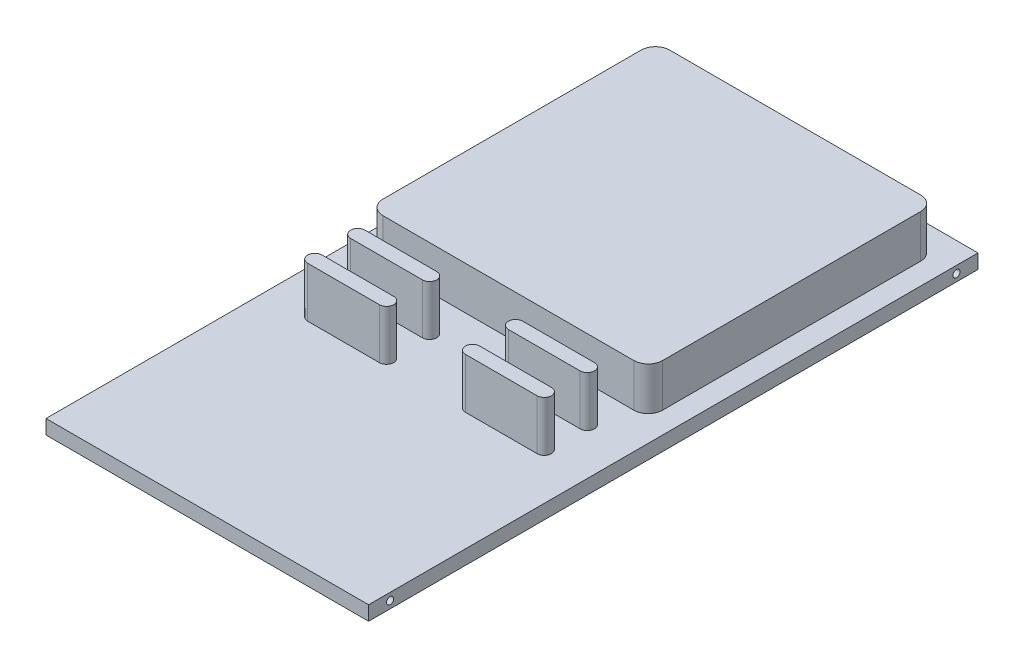
from build123d import *

# Parameters (mm, degrees)
SKETCH1_W           = 57.15
SKETCH1_H           = 107.95
BOSS_EXTRUDE1_DEPTH = 2.54
BOSS_EXTRUDE2_DEPTH = 8.89
SKETCH4_R           = 0.635
CUT_EXTRUDE1_DEPTH  = 10.16
SKETCH5_W           = 49.53
SKETCH5_H           = 50.8
BOSS_EXTRUDE3_DEPTH = 7.62
FILLET1_R           = 2.54


with BuildPart() as part:
    # Sketch1 → Boss-Extrude1 (new body)
    with BuildSketch(Plane(origin=(0, 0, 0), x_dir=(1, 0, 0), z_dir=(0, 1, 0))):
        with Locations((28.575, 53.975)):
            Rectangle(SKETCH1_W, SKETCH1_H)
    extrude(amount=BOSS_EXTRUDE1_DEPTH)

    # Sketch2 → Boss-Extrude2 (add)
    with BuildSketch(Plane(origin=(0, 2.54, 0), x_dir=(1, 0, 0), z_dir=(0, 1, 0))):
        with BuildLine():
            Line((8.255, 40.64), (20.955, 40.64))
            ThreePointArc((20.955, 40.64), (22.225, 39.37), (20.955, 38.1))
            Line((20.955, 38.1), (8.255, 38.1))
            ThreePointArc((8.255, 38.1), (6.985, 39.37), (8.255, 40.64))
        make_face()
        with BuildLine():
            Line((48.895, 40.64), (36.195, 40.64))
            ThreePointArc((36.195, 40.64), (34.925, 39.37), (36.195, 38.1))
            Line((36.195, 38.1), (48.895, 38.1))
            ThreePointArc((48.895, 38.1), (50.165, 39.37), (48.895, 40.64))
        make_face()
        with BuildLine():
            Line((8.255, 48.26), (20.955, 48.26))
            ThreePointArc((20.955, 48.26), (22.225, 46.99), (20.955, 45.72))
            Line((20.955, 45.72), (8.255, 45.72))
            ThreePointArc((8.255, 45.72), (6.985, 46.99), (8.255, 48.26))
        make_face()
        with BuildLine():
            Line((48.895, 48.26), (36.195, 48.26))
            ThreePointArc((36.195, 48.26), (34.925, 46.99), (36.195, 45.72))
            Line((36.195, 45.72), (48.895, 45.72))
            ThreePointArc((48.895, 45.72), (50.165, 46.99), (48.895, 48.26))
        make_face()
    extrude(amount=BOSS_EXTRUDE2_DEPTH)

    # Sketch4 → Cut-Extrude1 (cut)
    with BuildSketch(Plane.ZY):
        with Locations((-104.14, 1.27)):
            Circle(SKETCH4_R)
        with Locations(Location((-3.81, 1.27, 0), (0, 0, 180))):
            Circle(SKETCH4_R)
    cut_extrude1 = extrude(amount=-CUT_EXTRUDE1_DEPTH, mode=Mode.SUBTRACT)

    # Mirror1: Cut-Extrude1 across plane
    add(cut_extrude1.mirror(Plane.ZY.offset(-28.575)), mode=Mode.SUBTRACT)

    # Sketch5 → Boss-Extrude3 (add)
    with BuildSketch(Plane(origin=(0, 2.54, 0), x_dir=(1, 0, 0), z_dir=(0, 1, 0))):
        with Locations((28.575, 78.74)):
            Rectangle(SKETCH5_W, SKETCH5_H)
    extrude(amount=BOSS_EXTRUDE3_DEPTH)

    # Fillet1
    fillet1_edges = [part.edges().sort_by_distance(p)[0] for p in [
        (53.34, 6.35, -53.34),
        (53.34, 6.35, -104.14),
        (3.81, 6.35, -104.14),
        (3.81, 6.35, -53.34),
    ]]
    fillet(fillet1_edges, radius=FILLET1_R)


solid = part.part
